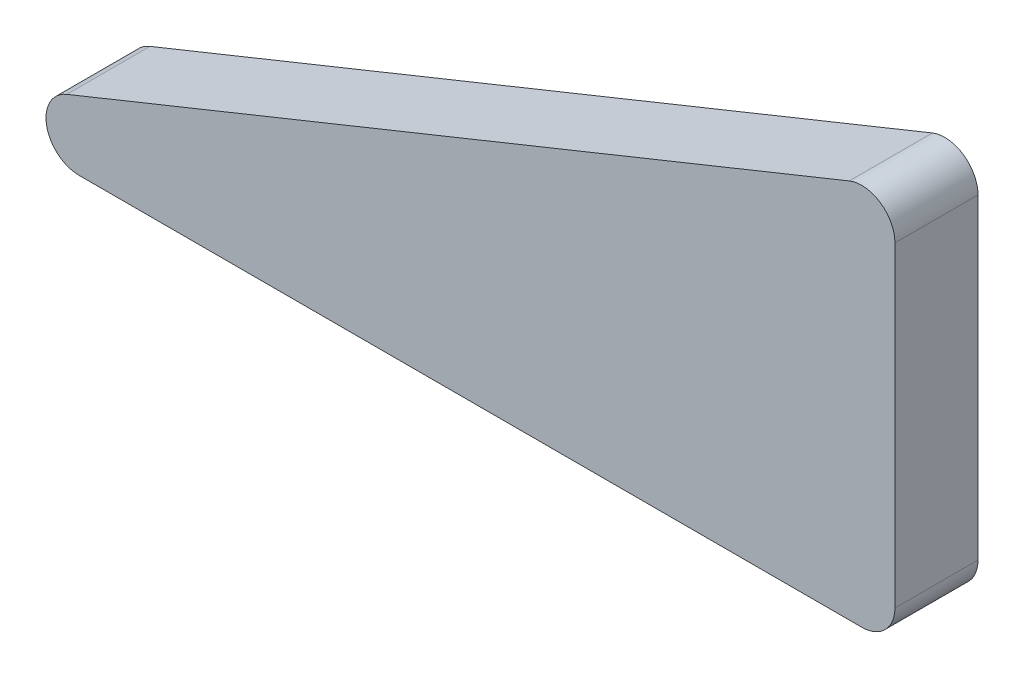
from build123d import *

# Parameters (mm, degrees)
BOSS_EXTRUDE1_DEPTH = 2.5


with BuildPart() as part:
    # Sketch1 → Boss-Extrude1 (new body)
    with BuildSketch(Plane.XY):
        with BuildLine():
            Line((5.143046602, 0), (28.69165592, 0))
            ThreePointArc((28.69165592, 0), (29.398762701, 0.292893219), (29.69165592, 1))
            Line((29.69165592, 1), (29.69165592, 10.517263456))
            ThreePointArc((29.69165592, 10.517263456), (29.25080331, 11.346331725), (28.316947529, 11.444406175))
            Line((28.316947529, 11.444406175), (4.76833821, 1.927142719))
            ThreePointArc((4.76833821, 1.927142719), (4.161429895, 0.809137116), (5.143046602, 0))
        make_face()
    extrude(amount=BOSS_EXTRUDE1_DEPTH)


solid = part.part
